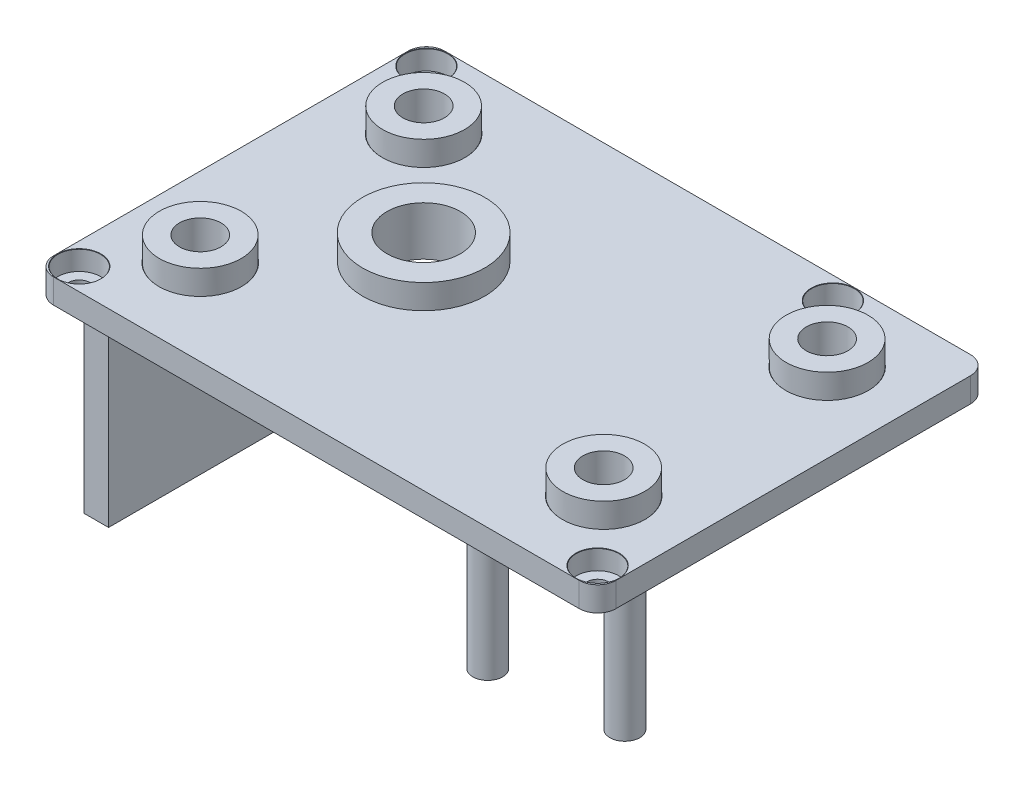
from build123d import *

# Parameters (mm, degrees)
SKETCH1_W                       = 46
SKETCH1_H                       = 32
BOSS_EXTRUDE1_DEPTH             = 2
CBORE_FOR_M3_SBHCS1_AT_2_COUNT  = 2
CBORE_FOR_M3_SBHCS1_AT_2_PITCH  = 18.273746641
CBORE_FOR_M3_SBHCS1_AT_3_COUNT  = 2
CBORE_FOR_M3_SBHCS1_AT_3_PITCH  = 37.721741957
CBORE_FOR_M3_SBHCS1_AT_4_COUNT  = 2
CBORE_FOR_M3_SBHCS1_AT_4_PITCH  = 33
BOSS_EXTRUDE2_START             = 3.63
SKETCH9_R                       = 3.35
SKETCH9_R_2                     = 1.7
BOSS_EXTRUDE2_DEPTH             = 3.63
SKETCH11_R                      = 5
SKETCH11_R_2                    = 3
BOSS_EXTRUDE3_DEPTH             = 2
CBORE_FOR_M1_6_SHCS1_AT_2_COUNT = 2
CBORE_FOR_M1_6_SHCS1_AT_2_PITCH = 33.25
CBORE_FOR_M1_6_SHCS1_AT_3_COUNT = 2
CBORE_FOR_M1_6_SHCS1_AT_3_PITCH = 51.03253864
CBORE_FOR_M1_6_SHCS1_AT_4_COUNT = 2
CBORE_FOR_M1_6_SHCS1_AT_4_PITCH = 28.4
CUT_EXTRUDE1_START              = -2
SKETCH17_R                      = 3
CUT_EXTRUDE1_DEPTH              = 2
FILLET1_R                       = 1.5
SKETCH18_W                      = 2
SKETCH18_H                      = 24
BOSS_EXTRUDE4_DEPTH             = 17.5
SKETCH19_R                      = 1.215
SKETCH19_R_2                    = 1.22
BOSS_EXTRUDE5_DEPTH             = 17.5


with BuildPart() as part:
    # Sketch1 → Boss-Extrude1 (new body)
    with BuildSketch(Plane(origin=(0, 0, 0), x_dir=(1, 0, 0), z_dir=(0, 1, 0))):
        with Locations((-23, -16)):
            Rectangle(SKETCH1_W, SKETCH1_H)
    extrude(amount=BOSS_EXTRUDE1_DEPTH)

    # Sketch7 → CBORE for M3 SBHCS1 (revolve, cut)
    with BuildSketch(Plane(origin=(-39.5, 2, 6.726253359), x_dir=(0, 0, 1), z_dir=(1, 0, 0))):
        Polygon((0, 0), (0, 3.021463052), (1.7, 2), (1.7, 1.65), (3.35, 1.65), (3.35, 0.025), (3.375, 0), align=None)
    cbore_for_m3_sbhcs1 = revolve(axis=Axis((-39.5, 8.35, 6.726253359), (0, -1, 0)), mode=Mode.SUBTRACT)

    # CBORE for M3 SBHCS1 at 2: CBORE for M3 SBHCS1 ×2
    with Locations(*[(0, 0, i * CBORE_FOR_M3_SBHCS1_AT_2_PITCH) for i in range(1, CBORE_FOR_M3_SBHCS1_AT_2_COUNT)]):
        add(cbore_for_m3_sbhcs1, mode=Mode.SUBTRACT)

    # CBORE for M3 SBHCS1 at 3: CBORE for M3 SBHCS1 ×2
    with Locations(*[Vector(0.874827043707974, 0, 0.4844353864006702) * (i * CBORE_FOR_M3_SBHCS1_AT_3_PITCH) for i in range(1, CBORE_FOR_M3_SBHCS1_AT_3_COUNT)]):
        add(cbore_for_m3_sbhcs1, mode=Mode.SUBTRACT)

    # CBORE for M3 SBHCS1 at 4: CBORE for M3 SBHCS1 ×2
    with Locations(*[(i * CBORE_FOR_M3_SBHCS1_AT_4_PITCH, 0, 0) for i in range(1, CBORE_FOR_M3_SBHCS1_AT_4_COUNT)]):
        add(cbore_for_m3_sbhcs1, mode=Mode.SUBTRACT)

    # Sketch9 → Boss-Extrude2 (add)
    # profile 1 of 4: a face of its own
    with BuildSketch(Plane(origin=(-49.887058416, 0.35, -0.273746641), x_dir=(1, 0, 0), z_dir=(0, 1, 0)).offset(BOSS_EXTRUDE2_START)):
        with Locations(Location((10.387058416, -25.273746641, 0), (0, 0, 90))):
            Circle(SKETCH9_R)
        with Locations(Location((10.387058416, -25.273746641, 0), (0, 0, 270))):
            Circle(SKETCH9_R_2, mode=Mode.SUBTRACT)
    # profile 2 of 4: a face of its own
    with BuildSketch(Plane(origin=(-49.887058416, 0.35, -0.273746641), x_dir=(1, 0, 0), z_dir=(0, 1, 0)).offset(BOSS_EXTRUDE2_START)):
        with Locations(Location((43.387058416, -25.273746641, 0), (0, 0, 90))):
            Circle(SKETCH9_R)
        with Locations(Location((43.387058416, -25.273746641, 0), (0, 0, 270))):
            Circle(SKETCH9_R_2, mode=Mode.SUBTRACT)
    # profile 3 of 4: a face of its own
    with BuildSketch(Plane(origin=(-49.887058416, 0.35, -0.273746641), x_dir=(1, 0, 0), z_dir=(0, 1, 0)).offset(BOSS_EXTRUDE2_START)):
        with Locations(Location((43.387058416, -7, 0), (0, 0, 90))):
            Circle(SKETCH9_R)
        with Locations(Location((43.387058416, -7, 0), (0, 0, 270))):
            Circle(SKETCH9_R_2, mode=Mode.SUBTRACT)
    # profile 4 of 4: a face of its own
    with BuildSketch(Plane(origin=(-49.887058416, 0.35, -0.273746641), x_dir=(1, 0, 0), z_dir=(0, 1, 0)).offset(BOSS_EXTRUDE2_START)):
        with Locations(Location((10.387058416, -7, 0), (0, 0, 90))):
            Circle(SKETCH9_R)
        with Locations(Location((10.387058416, -7, 0), (0, 0, 270))):
            Circle(SKETCH9_R_2, mode=Mode.SUBTRACT)
    extrude(amount=-BOSS_EXTRUDE2_DEPTH)

    # Sketch11 → Boss-Extrude3 (add)
    with BuildSketch(Plane(origin=(-49.887058416, 2, -0.273746641), x_dir=(1, 0, 0), z_dir=(0, 1, 0))):
        with Locations(Location((19.387058416, -16, 0), (0, 0, 270))):
            Circle(SKETCH11_R)
        with Locations(Location((19.387058416, -16, 0), (0, 0, 270))):
            Circle(SKETCH11_R_2, mode=Mode.SUBTRACT)
    extrude(amount=BOSS_EXTRUDE3_DEPTH)

    # Sketch16 → CBORE for M1.6 SHCS1 (revolve, cut)
    with BuildSketch(Plane(origin=(-44.2, 2, 1.8), x_dir=(0, 0, 1), z_dir=(1, 0, 0))):
        Polygon((0, 0), (0, 2), (0.9, 2), (0.9, 1.6), (1.75, 1.6), (1.75, 0.025), (1.775, 0), align=None)
    cbore_for_m1_6_shcs1 = revolve(axis=Axis((-44.2, 8.35, 1.8), (0, -1, 0)), mode=Mode.SUBTRACT)

    # CBORE for M1.6 SHCS1 at 2: CBORE for M1.6 SHCS1 ×2
    with Locations(*[(i * CBORE_FOR_M1_6_SHCS1_AT_2_PITCH, 0, 0) for i in range(1, CBORE_FOR_M1_6_SHCS1_AT_2_COUNT)]):
        add(cbore_for_m1_6_shcs1, mode=Mode.SUBTRACT)

    # CBORE for M1.6 SHCS1 at 3: CBORE for M1.6 SHCS1 ×2
    with Locations(*[Vector(0.8308424611100395, 0, 0.5565076862152155) * (i * CBORE_FOR_M1_6_SHCS1_AT_3_PITCH) for i in range(1, CBORE_FOR_M1_6_SHCS1_AT_3_COUNT)]):
        add(cbore_for_m1_6_shcs1, mode=Mode.SUBTRACT)

    # CBORE for M1.6 SHCS1 at 4: CBORE for M1.6 SHCS1 ×2
    with Locations(*[(0, 0, i * CBORE_FOR_M1_6_SHCS1_AT_4_PITCH) for i in range(1, CBORE_FOR_M1_6_SHCS1_AT_4_COUNT)]):
        add(cbore_for_m1_6_shcs1, mode=Mode.SUBTRACT)

    # Sketch17 → Cut-Extrude1 (cut)
    with BuildSketch(Plane(origin=(0, 2, 0), x_dir=(1, 0, 0), z_dir=(0, 1, 0)).offset(CUT_EXTRUDE1_START)):
        with Locations(Location((-30.5, -15.726253359, 0), (0, 0, 270))):
            Circle(SKETCH17_R)
    extrude(amount=CUT_EXTRUDE1_DEPTH, mode=Mode.SUBTRACT)

    # Fillet1
    fillet1_edges = [part.edges().sort_by_distance(p)[0] for p in [
        (0, 1, 32),
        (0, 1, 0),
        (-46, 1, 0),
        (-46, 1, 32),
    ]]
    fillet(fillet1_edges, radius=FILLET1_R)

    # Sketch18 → Boss-Extrude4 (add)
    with BuildSketch(Plane.XZ):
        with Locations((-45, 16)):
            Rectangle(SKETCH18_W, SKETCH18_H)
    extrude(amount=BOSS_EXTRUDE4_DEPTH)

    # Sketch19 → Boss-Extrude5 (add)
    with BuildSketch(Plane.XZ):
        with Locations(Location((-18.516057742, 22.467738948, 0), (0, 0, 90))):
            Circle(SKETCH19_R)
        with Locations(Location((-8.600917975, 21.167737636, 0), (0, 0, 90))):
            Circle(SKETCH19_R_2)
    extrude(amount=BOSS_EXTRUDE5_DEPTH)


solid = part.part
